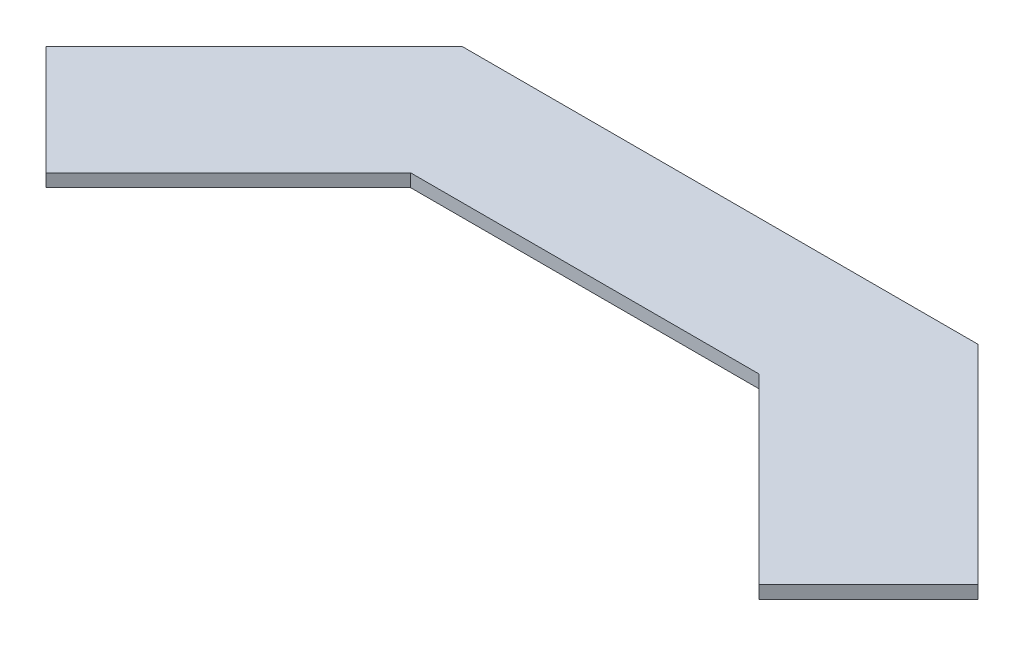
from build123d import *

# Parameters (mm, degrees)
BOSS_EXTRUDE1_DEPTH = 6.35


with BuildPart() as part:
    # Sketch1 → Boss-Extrude1 (new body)
    with BuildSketch(Plane(origin=(0, 0, 0), x_dir=(1, 0, 0), z_dir=(0, 1, 0))):
        Polygon((-229.502561211, -35.921024484), (-166.640768363, 26.940768363), (-127, 66.581536726), (127, 66.581536726), (166.640768363, 26.940768363), (229.502561211, -35.921024484), (175.621024484, -89.802561211), (85.818463274, 0), (-85.818463274, 0), (-175.621024484, -89.802561211), align=None)
    extrude(amount=BOSS_EXTRUDE1_DEPTH)


solid = part.part
